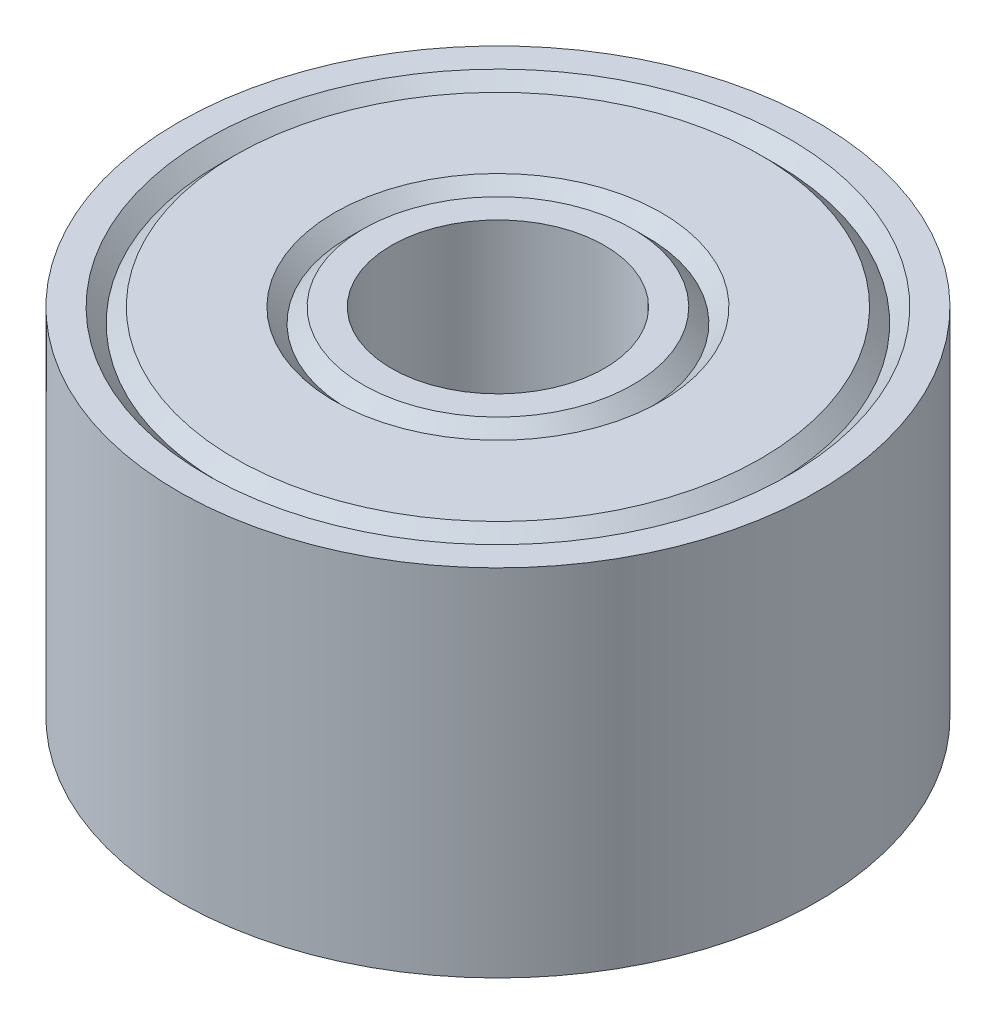
from build123d import *


with BuildPart() as part:
    # Sketch1 → Revolve1 (revolve)
    with BuildSketch(Plane.XY):
        Polygon((-1.5, 2.5), (-1.9, 2.5), (-2.1, 2.3), (-2.3, 2.5), (-3.7, 2.5), (-3.9, 2.3), (-4.1, 2.5), (-4.5, 2.5), (-4.5, -2.5), (-4.1, -2.5), (-3.9, -2.3), (-3.7, -2.5), (-2.3, -2.5), (-2.1, -2.3), (-1.9, -2.5), (-1.5, -2.5), align=None)
    revolve(axis=Axis((0, 2.5, 0), (0, -1, 0)))


solid = part.part
